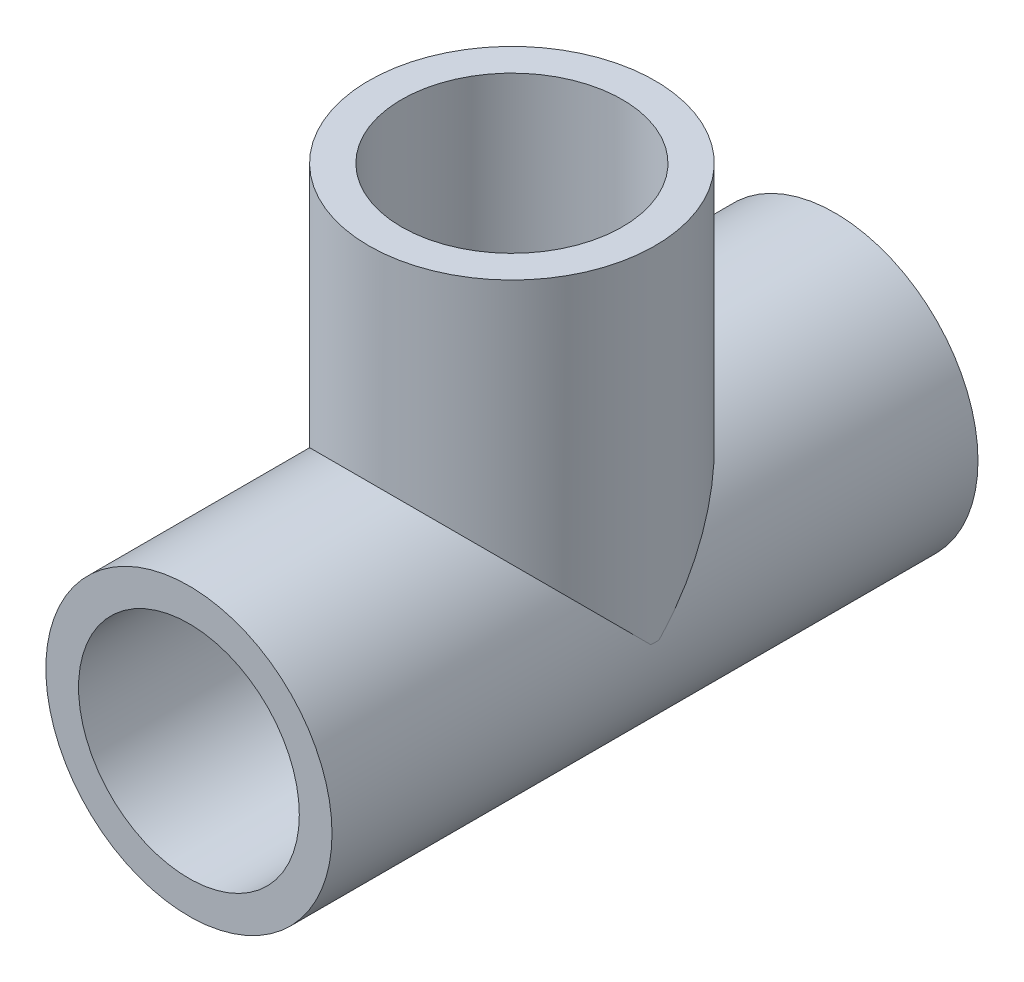
from build123d import *

# Parameters (mm, degrees)
SKETCH1_R                = 17.5
SKETCH1_R_2              = 13.5
BOSS_EXTRUDE2_DEPTH      = 25
BOSS_EXTRUDE2_DEPTH_BACK = 17
SKETCH2_R                = 17.5
SKETCH3_R                = 13.5
CUT_EXTRUDE1_DEPTH       = 92.39748364
CUT_EXTRUDE2_REACH       = 102.734
CUT_EXTRUDE2_END_RADIUS  = 13.5
SKETCH4_R                = 13.5


with BuildPart() as part:
    # Sweep1: sweep along a curve in space
    with BuildLine() as sweep1_path:
        Line((0, 0, 0), (0, 0, -79))
    # Sketch1 → Sweep1 (sweep)
    with BuildSketch(Plane.XY):
        Circle(SKETCH1_R)
        Circle(SKETCH1_R_2, mode=Mode.SUBTRACT)
    sweep(path=sweep1_path.line)

    # Sketch2 → Boss-Extrude2 (add, two sides: drawn at the far end of the back side and taken through both)
    with BuildSketch(Plane(origin=(0, 17.5, 0), x_dir=(1, 0, 0), z_dir=(0, 1, 0)).offset(-BOSS_EXTRUDE2_DEPTH_BACK)):
        with Locations(Location((0, 39.5, 0), (0, 0, 270))):
            Circle(SKETCH2_R)
    extrude(amount=BOSS_EXTRUDE2_DEPTH + BOSS_EXTRUDE2_DEPTH_BACK)

    # Sketch3 → Cut-Extrude1 (cut, through all)
    with BuildSketch(Plane.XY):
        Circle(SKETCH3_R)
    extrude(amount=-CUT_EXTRUDE1_DEPTH, mode=Mode.SUBTRACT)

    # Cut-Extrude2: up to this cylinder (the profile starts outside it)
    cut_extrude2_end = Plane(origin=(0, 0, -39.5), z_dir=(0, 0, -1)) * Cylinder(CUT_EXTRUDE2_END_RADIUS, 233.468, mode=Mode.PRIVATE)
    # Sketch4 → Cut-Extrude2 (cut, up to the surface)
    with BuildSketch(Plane(origin=(0, 42.5, 0), x_dir=(1, 0, 0), z_dir=(0, 1, 0)), mode=Mode.PRIVATE) as cut_extrude2_sk1:
        with Locations(Location((0, 39.5, 0), (0, 0, 270))):
            Circle(SKETCH4_R)
    cut_extrude2_tool1 = extrude(cut_extrude2_sk1.sketch, amount=-CUT_EXTRUDE2_REACH, mode=Mode.PRIVATE) - cut_extrude2_end
    add(cut_extrude2_tool1.solids().sort_by_distance((0, 42.5, -39.5))[0], mode=Mode.SUBTRACT)


solid = part.part
